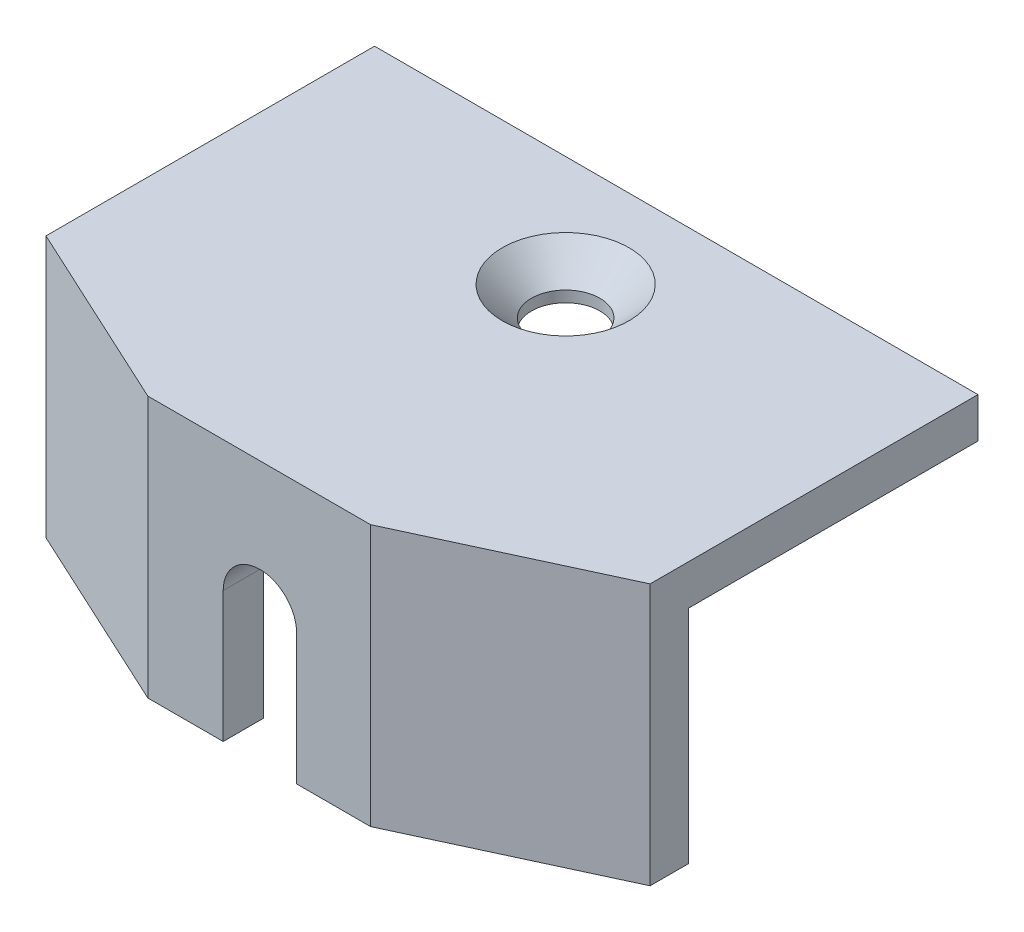
from build123d import *

# Parameters (mm, degrees)
BOSS_EXTRUDE1_DEPTH = 2
BOSS_EXTRUDE2_DEPTH = 13
CUT_EXTRUDE1_DEPTH  = 7


with BuildPart() as part:
    # Sketch1 → Boss-Extrude1 (new body)
    with BuildSketch(Plane(origin=(0, 0, 0), x_dir=(1, 0, 0), z_dir=(0, 1, 0))):
        Polygon((-15, -14.4), (-15, 0), (15, 0), (15, -14.4), (5.71590909, -18.700000004), (-5.71590909, -18.700000004), align=None)
    extrude(amount=BOSS_EXTRUDE1_DEPTH)

    # Sketch3 → CSK for M3 Flat Head Machine Screw1 (revolve, cut)
    with BuildSketch(Plane(origin=(0, 2, 5.5), x_dir=(0, 0, 1), z_dir=(1, 0, 0))):
        Polygon((0, 0), (0, 2), (1.7, 2), (1.7, 1.45), (3.15, 0), align=None)
    revolve(axis=Axis((0, 8.35, 5.5), (0, -1, 0)), mode=Mode.SUBTRACT)

    # Sketch4 → Boss-Extrude2 (add)
    with BuildSketch(Plane(origin=(0, 2, 0), x_dir=(1, 0, 0), z_dir=(0, 1, 0))):
        Polygon((-15, -14.4), (-15, -16.33369736), (-5.572755662, -20.700000004), (5.5, -20.700000004), (15, -16.3), (15, -14.4), (5.71590909, -18.700000004), (-5.71590909, -18.700000004), align=None)
    extrude(amount=-BOSS_EXTRUDE2_DEPTH)

    # Sketch5 → Cut-Extrude1 (cut)
    with BuildSketch(Plane.XY.offset(20.700000004)):
        with BuildLine():
            Line((1.825, -4.5), (1.825, -11))
            ThreePointArc((1.825, -11), (0, -12.825), (-1.825, -11))
            Line((-1.825, -11), (-1.825, -4.5))
            ThreePointArc((-1.825, -4.5), (0, -2.675), (1.825, -4.5))
        make_face()
    extrude(amount=-CUT_EXTRUDE1_DEPTH, mode=Mode.SUBTRACT)


solid = part.part
